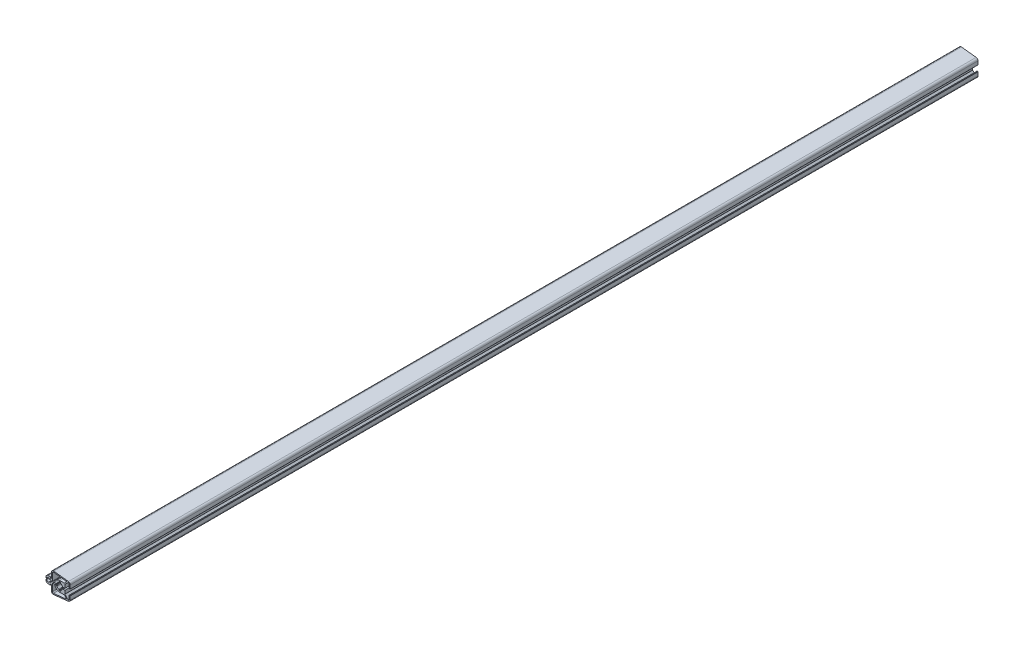
from build123d import *

# Parameters (mm, degrees)
EXTRUDE1_DEPTH = 1300


with BuildPart() as part:
    # Sketch1 → Extrude1 (new body)
    with BuildSketch(Plane.XY):
        with BuildLine():
            Line((21.490009074, 1.2), (22.34167412, 1.2))
            ThreePointArc((22.34167412, 1.2), (22.757184066, 1.325619119), (23.033504697, 1.66039604))
            ThreePointArc((23.033504697, 1.66039604), (23.959440841, 3.040559159), (25.33960396, 3.966495303))
            ThreePointArc((25.33960396, 3.966495303), (25.674380881, 4.242815934), (25.8, 4.65832588))
            Line((25.8, 4.65832588), (25.8, 5.509990926))
            ThreePointArc((25.8, 5.509990926), (25.846470105, 5.638164914), (25.964285714, 5.706776316))
            ThreePointArc((25.964285714, 5.706776316), (27, 5.8), (28.035714286, 5.706776316))
            ThreePointArc((28.035714286, 5.706776316), (28.153529895, 5.638164914), (28.2, 5.509990926))
            Line((28.2, 5.509990926), (28.2, 4.65832588))
            ThreePointArc((28.2, 4.65832588), (28.325619119, 4.242815934), (28.66039604, 3.966495303))
            ThreePointArc((28.66039604, 3.966495303), (30.040559159, 3.040559159), (30.966495303, 1.66039604))
            ThreePointArc((30.966495303, 1.66039604), (31.242815934, 1.325619119), (31.65832588, 1.2))
            Line((31.65832588, 1.2), (34.3, 1.2))
            Line((34.3, 1.2), (34.3, 5.944365081))
            ThreePointArc((34.3, 5.944365081), (34.315224093, 6.020901768), (34.358578644, 6.085786438))
            Line((34.358578644, 6.085786438), (39.053219906, 10.7804277))
            ThreePointArc((39.053219906, 10.7804277), (39.09082989, 10.804079854), (39.134973737, 10.809105395))
            Line((39.134973737, 10.809105395), (39.165647289, 10.805697223))
            ThreePointArc((39.165647289, 10.805697223), (40.117692027, 10.315253814), (40.5, 9.314871621))
            Line((40.5, 9.314871621), (40.5, 4.3))
            ThreePointArc((40.5, 4.3), (40.558578644, 4.158578644), (40.7, 4.1))
            Line((40.7, 4.1), (41.8, 4.1))
            ThreePointArc((41.8, 4.1), (41.941421356, 4.158578644), (42, 4.3))
            Line((42, 4.3), (42, 9.314871621))
            ThreePointArc((42, 9.314871621), (41.235384054, 11.315636008), (39.331294578, 12.296522825))
            Line((39.331294578, 12.296522825), (18.331294578, 14.629856158))
            ThreePointArc((18.331294578, 14.629856158), (15.999235613, 13.883589008), (15, 11.648204954))
            Line((15, 11.648204954), (15, 3.87298837))
            ThreePointArc((15, 3.87298837), (14.684748025, 3.408372219), (14.13652733, 3.529640706))
            ThreePointArc((14.13652733, 3.529640706), (13.848340865, 3.811685359), (13.538931751, 4.070271178))
            ThreePointArc((13.538931751, 4.070271178), (13.510259193, 4.105338584), (13.5, 4.149458734))
            Line((13.5, 4.149458734), (13.5, 5.04003891))
            ThreePointArc((13.5, 5.04003891), (13.470710678, 5.110749588), (13.4, 5.14003891))
            Line((13.4, 5.14003891), (10.4, 5.14003891))
            ThreePointArc((10.4, 5.14003891), (10.279875007, 5.138635031), (10.159815633, 5.134424161))
            ThreePointArc((10.159815633, 5.134424161), (8.129682846, 4.208865984), (7.3, 2.137701227))
            Line((7.3, 2.137701227), (7.3, 0.95))
            ThreePointArc((7.3, 0.95), (7.358578644, 0.808578644), (7.5, 0.75))
            Line((7.5, 0.75), (7.872649609, 0.75))
            ThreePointArc((7.872649609, 0.75), (7.986504617, 0.785570571), (8.059860749, 0.87962963))
            ThreePointArc((8.059860749, 0.87962963), (9.999819413, 2.467763258), (12.342238608, 1.574074074))
            ThreePointArc((12.342238608, 1.574074074), (12.4115514, 1.519465813), (12.497617696, 1.5))
            Line((12.497617696, 1.5), (13.5, 1.5))
            ThreePointArc((13.5, 1.5), (15, 0), (13.5, -1.5))
            Line((13.5, -1.5), (12.497617696, -1.5))
            ThreePointArc((12.497617696, -1.5), (12.4115514, -1.519465813), (12.342238608, -1.574074074))
            ThreePointArc((12.342238608, -1.574074074), (9.999819413, -2.467763258), (8.059860749, -0.87962963))
            ThreePointArc((8.059860749, -0.87962963), (7.986504617, -0.785570571), (7.872649609, -0.75))
            Line((7.872649609, -0.75), (7.5, -0.75))
            ThreePointArc((7.5, -0.75), (7.358578644, -0.808578644), (7.3, -0.95))
            Line((7.3, -0.95), (7.3, -2.137701227))
            ThreePointArc((7.3, -2.137701227), (8.129682846, -4.208865984), (10.159815633, -5.134424161))
            ThreePointArc((10.159815633, -5.134424161), (10.279875007, -5.138635031), (10.4, -5.14003891))
            Line((10.4, -5.14003891), (13.4, -5.14003891))
            ThreePointArc((13.4, -5.14003891), (13.470710678, -5.110749588), (13.5, -5.04003891))
            Line((13.5, -5.04003891), (13.5, -4.149458734))
            ThreePointArc((13.5, -4.149458734), (13.510259193, -4.105338584), (13.538931751, -4.070271178))
            ThreePointArc((13.538931751, -4.070271178), (13.848340865, -3.811685359), (14.13652733, -3.529640706))
            ThreePointArc((14.13652733, -3.529640706), (14.684748025, -3.408372219), (15, -3.87298837))
            Line((15, -3.87298837), (15, -11.648204954))
            ThreePointArc((15, -11.648204954), (15.999235613, -13.883589008), (18.331294578, -14.629856158))
            Line((18.331294578, -14.629856158), (39.331294578, -12.296522825))
            ThreePointArc((39.331294578, -12.296522825), (41.235384054, -11.315636008), (42, -9.314871621))
            Line((42, -9.314871621), (42, -4.3))
            ThreePointArc((42, -4.3), (41.941421356, -4.158578644), (41.8, -4.1))
            Line((41.8, -4.1), (40.7, -4.1))
            ThreePointArc((40.7, -4.1), (40.558578644, -4.158578644), (40.5, -4.3))
            Line((40.5, -4.3), (40.5, -9.314871621))
            ThreePointArc((40.5, -9.314871621), (40.117692027, -10.315253814), (39.165647289, -10.805697223))
            Line((39.165647289, -10.805697223), (39.134973737, -10.809105395))
            ThreePointArc((39.134973737, -10.809105395), (39.09082989, -10.804079854), (39.053219906, -10.7804277))
            Line((39.053219906, -10.7804277), (34.358578644, -6.085786438))
            ThreePointArc((34.358578644, -6.085786438), (34.315224093, -6.020901768), (34.3, -5.944365081))
            Line((34.3, -5.944365081), (34.3, -1.2))
            Line((34.3, -1.2), (31.65832588, -1.2))
            ThreePointArc((31.65832588, -1.2), (31.242815934, -1.325619119), (30.966495303, -1.66039604))
            ThreePointArc((30.966495303, -1.66039604), (30.040559159, -3.040559159), (28.66039604, -3.966495303))
            ThreePointArc((28.66039604, -3.966495303), (28.325619119, -4.242815934), (28.2, -4.65832588))
            Line((28.2, -4.65832588), (28.2, -5.509990926))
            ThreePointArc((28.2, -5.509990926), (28.153529895, -5.638164914), (28.035714286, -5.706776316))
            ThreePointArc((28.035714286, -5.706776316), (27, -5.8), (25.964285714, -5.706776316))
            ThreePointArc((25.964285714, -5.706776316), (25.846470105, -5.638164914), (25.8, -5.509990926))
            Line((25.8, -5.509990926), (25.8, -4.65832588))
            ThreePointArc((25.8, -4.65832588), (25.674380881, -4.242815934), (25.33960396, -3.966495303))
            ThreePointArc((25.33960396, -3.966495303), (23.959440841, -3.040559159), (23.033504697, -1.66039604))
            ThreePointArc((23.033504697, -1.66039604), (22.757184066, -1.325619119), (22.34167412, -1.2))
            Line((22.34167412, -1.2), (21.490009074, -1.2))
            ThreePointArc((21.490009074, -1.2), (21.361835086, -1.153529895), (21.293223684, -1.035714286))
            ThreePointArc((21.293223684, -1.035714286), (21.2, 0), (21.293223684, 1.035714286))
            ThreePointArc((21.293223684, 1.035714286), (21.361835086, 1.153529895), (21.490009074, 1.2))
        make_face()
        with BuildLine():
            Line((16.5, -1.25), (16.5, -11.648204954))
            ThreePointArc((16.5, -11.648204954), (16.999617806, -12.765896981), (18.165647289, -13.139030556))
            Line((18.165647289, -13.139030556), (36.764437067, -11.072498358))
            ThreePointArc((36.764437067, -11.072498358), (36.931076425, -10.939923), (36.883772118, -10.732300255))
            Line((36.883772118, -10.732300255), (33.510050506, -7.358578644))
            ThreePointArc((33.510050506, -7.358578644), (33.445165837, -7.315224093), (33.36862915, -7.3))
            Line((33.36862915, -7.3), (27, -7.3))
            ThreePointArc((27, -7.3), (22.343811305, -5.622268833), (19.827850799, -1.360248447))
            ThreePointArc((19.827850799, -1.360248447), (19.569361706, -0.92236964), (19.090986155, -0.75))
            Line((19.090986155, -0.75), (17, -0.75))
            ThreePointArc((17, -0.75), (16.646446609, -0.896446609), (16.5, -1.25))
        make_face(mode=Mode.SUBTRACT)
        with BuildLine():
            Line((17, 0.75), (19.090986155, 0.75))
            ThreePointArc((19.090986155, 0.75), (19.569361706, 0.92236964), (19.827850799, 1.360248447))
            ThreePointArc((19.827850799, 1.360248447), (22.343811305, 5.622268833), (27, 7.3))
            Line((27, 7.3), (33.36862915, 7.3))
            ThreePointArc((33.36862915, 7.3), (33.445165837, 7.315224093), (33.510050506, 7.358578644))
            Line((33.510050506, 7.358578644), (36.883772118, 10.732300255))
            ThreePointArc((36.883772118, 10.732300255), (36.931076425, 10.939923), (36.764437067, 11.072498358))
            Line((36.764437067, 11.072498358), (18.165647289, 13.139030556))
            ThreePointArc((18.165647289, 13.139030556), (16.999617806, 12.765896981), (16.5, 11.648204954))
            Line((16.5, 11.648204954), (16.5, 1.25))
            ThreePointArc((16.5, 1.25), (16.646446609, 0.896446609), (17, 0.75))
        make_face(mode=Mode.SUBTRACT)
    extrude(amount=EXTRUDE1_DEPTH)


solid = part.part
